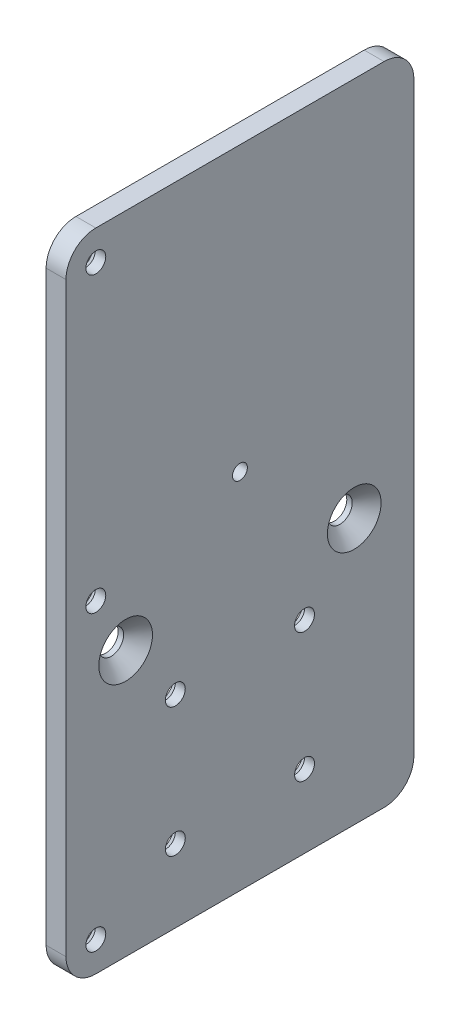
from build123d import *

# Parameters (mm, degrees)
SKETCH_1_W          = 70
SKETCH_1_H          = 130
EXTRUDE_1_DEPTH     = 4
SKETCH_2_R          = 2
CUT_EXTRUDE_1_DEPTH = 10
FILLET_1_R          = 6
CHAMFER_1_SIZE      = 2
SKETCH_3_R          = 2
CUT_EXTRUDE_2_DEPTH = 15
CHAMFER_2_SIZE      = 1.9
SKETCH_4_R          = 2.5
CUT_EXTRUDE_3_DEPTH = 15
CHAMFER_3_SIZE      = 2.9
SKETCH_5_R          = 1.5
CUT_EXTRUDE_4_DEPTH = 12


with BuildPart() as part:
    # Эскиз1 → Бобышка-Вытянуть1 (new body)
    with BuildSketch(Plane(origin=(0, 0, 0), x_dir=(0, 0, -1), z_dir=(1, 0, 0))):
        with Locations((15.001853179, -3.931833533)):
            Rectangle(SKETCH_1_W, SKETCH_1_H)
    extrude(amount=EXTRUDE_1_DEPTH)

    # Эскиз2 → Вырез-Вытянуть1 (cut)
    with BuildSketch(Plane.ZY):
        with Locations((-28.001653179, -28.231733533)):
            Circle(SKETCH_2_R)
        with Locations((-28.001653179, -54.231733533)):
            Circle(SKETCH_2_R)
        with Locations((-2.001653179, -28.231733533)):
            Circle(SKETCH_2_R)
        with Locations((-2.001653179, -54.231733533)):
            Circle(SKETCH_2_R)
    extrude(amount=-CUT_EXTRUDE_1_DEPTH, mode=Mode.SUBTRACT)

    # Скругление1
    fillet_1_edges = [part.edges().sort_by_distance(p)[0] for p in [
        (2, 61.068166467, 19.998146821),
        (2, 61.068166467, -50.001853179),
        (2, -68.931833533, -50.001853179),
        (2, -68.931833533, 19.998146821),
    ]]
    fillet(fillet_1_edges, radius=FILLET_1_R)

    # Фаска1
    chamfer_1_edges = [part.edges().sort_by_distance(p)[0] for p in [
        (0, -28.231733533, -30.001653179),
        (0, -54.231733533, -30.001653179),
        (0, -28.231733533, -4.001653179),
        (0, -54.231733533, -4.001653179),
    ]]
    chamfer(chamfer_1_edges, length=CHAMFER_1_SIZE)

    # Эскиз3 → Вырез-Вытянуть2 (cut)
    with BuildSketch(Plane.ZY):
        with Locations((13.998146821, 55.068166467)):
            Circle(SKETCH_3_R)
        with Locations((13.998146821, -62.931833533)):
            Circle(SKETCH_3_R)
        with Locations((13.998146821, -3.931833533)):
            Circle(SKETCH_3_R)
    extrude(amount=-CUT_EXTRUDE_2_DEPTH, mode=Mode.SUBTRACT)

    # Фаска2
    chamfer_2_edges = [part.edges().sort_by_distance(p)[0] for p in [
        (0, 55.068166467, 11.998146821),
        (0, -62.931833533, 11.998146821),
        (0, -3.931833533, 11.998146821),
    ]]
    chamfer(chamfer_2_edges, length=CHAMFER_2_SIZE)

    # Эскиз4 → Вырез-Вытянуть3 (cut)
    with BuildSketch(Plane(origin=(4, 0, 0), x_dir=(0, 0, -1), z_dir=(1, 0, 0))):
        with Locations((-7.998146821, -15.531833533)):
            Circle(SKETCH_4_R)
        with Locations((38.001853179, -15.531833533)):
            Circle(SKETCH_4_R)
    extrude(amount=-CUT_EXTRUDE_3_DEPTH, mode=Mode.SUBTRACT)

    # Фаска3
    chamfer_3_edges = [part.edges().sort_by_distance(p)[0] for p in [
        (4, -15.531833533, -35.501853179),
        (4, -15.531833533, 10.498146821),
    ]]
    chamfer(chamfer_3_edges, length=CHAMFER_3_SIZE)

    # Эскиз5 → Вырез-Вытянуть4 (cut)
    with BuildSketch(Plane.ZY):
        with Locations((-15.001853179, 4.068166467)):
            Circle(SKETCH_5_R)
    extrude(amount=-CUT_EXTRUDE_4_DEPTH, mode=Mode.SUBTRACT)


solid = part.part
